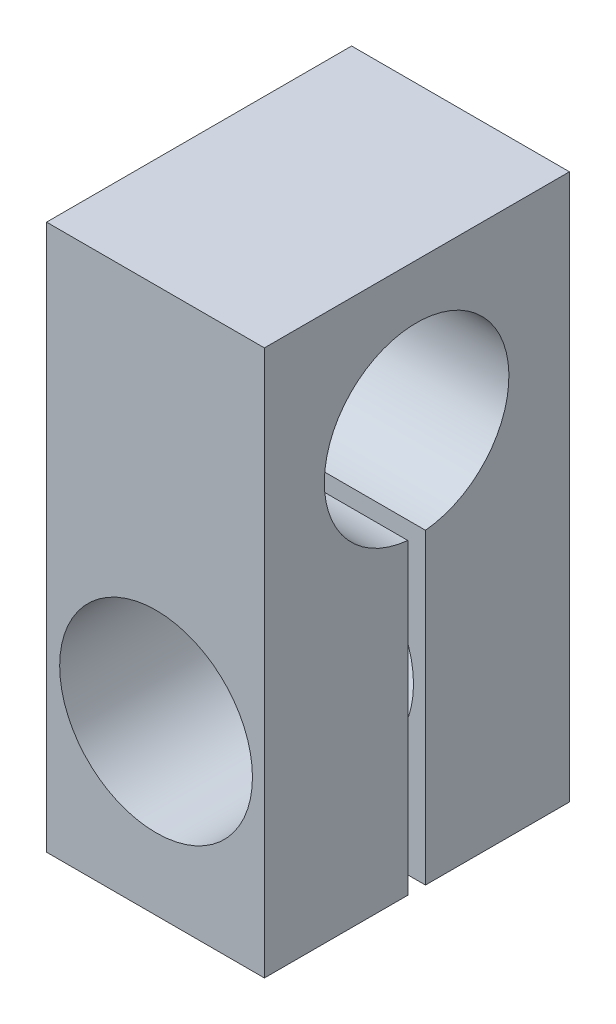
from build123d import *

# Parameters (mm, degrees)
BOSS_EXTRUDE1_DEPTH = 3.5875
SKETCH2_R           = 1.5875
CUT_EXTRUDE1_DEPTH  = 5.5875


with BuildPart() as part:
    # Sketch1 → Boss-Extrude1 (new body)
    with BuildSketch(Plane(origin=(0, 0, 0), x_dir=(0, 0, -1), z_dir=(1, 0, 0))):
        with BuildLine():
            Line((1.55613054, -9.91539795), (3.917713804, -9.916320319))
            Line((3.917713804, -9.916320319), (3.917713804, -4.855498596))
            ThreePointArc((3.917713804, -4.855498596), (4.062635704, -1.822441499), (4.208325788, -4.855461794))
            Line((4.208325788, -4.855461794), (4.208325788, -9.916433824))
            Line((4.208325788, -9.916433824), (6.579674081, -9.917360006))
            Line((6.579674081, -9.917360006), (6.579674081, -0.928463249))
            Line((6.579674081, -0.928463249), (1.55613054, -0.928463249))
            Line((1.55613054, -0.928463249), (1.55613054, -9.91539795))
        make_face()
    extrude(amount=BOSS_EXTRUDE1_DEPTH)

    # Sketch2 → Cut-Extrude1 (cut)
    with BuildSketch(Plane.XY.offset(-1.55613054)):
        with Locations((1.803311416, -7.149324499)):
            Circle(SKETCH2_R)
    extrude(amount=-CUT_EXTRUDE1_DEPTH, mode=Mode.SUBTRACT)


solid = part.part
